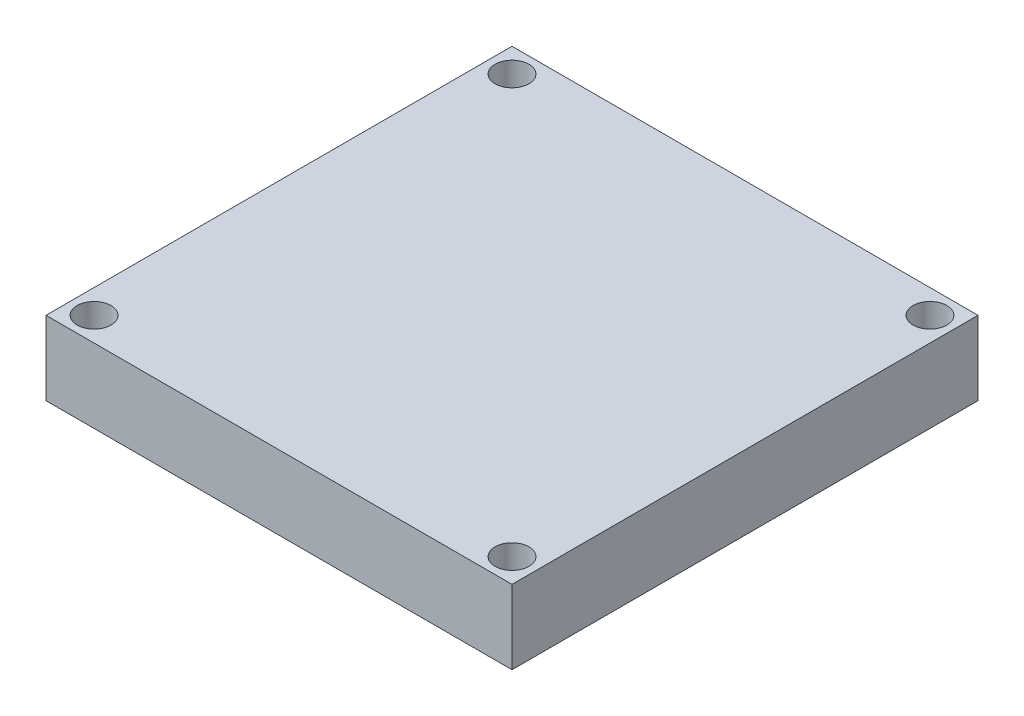
from build123d import *

# Parameters (mm, degrees)
SKETCH1_W           = 80.01
SKETCH1_H           = 80.01
BOSS_EXTRUDE1_DEPTH = 12.7
SKETCH2_R           = 2.9083
CUT_EXTRUDE1_DEPTH  = 58.983532576


with BuildPart() as part:
    # Sketch1 → Boss-Extrude1 (new body)
    with BuildSketch(Plane(origin=(0, 0, 0), x_dir=(1, 0, 0), z_dir=(0, 1, 0))):
        Rectangle(SKETCH1_W, SKETCH1_H)
    extrude(amount=BOSS_EXTRUDE1_DEPTH)

    # Sketch2 → Cut-Extrude1 (cut, through all)
    with BuildSketch(Plane(origin=(0, 12.7, 0), x_dir=(1, 0, 0), z_dir=(0, 1, 0))):
        with Locations(Location((-35.8775, 35.8775, 0), (0, 0, 270))):
            Circle(SKETCH2_R)
        with Locations(Location((35.8775, 35.8775, 0), (0, 0, 270))):
            Circle(SKETCH2_R)
        with Locations(Location((-35.8775, -35.8775, 0), (0, 0, 270))):
            Circle(SKETCH2_R)
        with Locations(Location((35.8775, -35.8775, 0), (0, 0, 270))):
            Circle(SKETCH2_R)
    extrude(amount=-CUT_EXTRUDE1_DEPTH, mode=Mode.SUBTRACT)


solid = part.part
